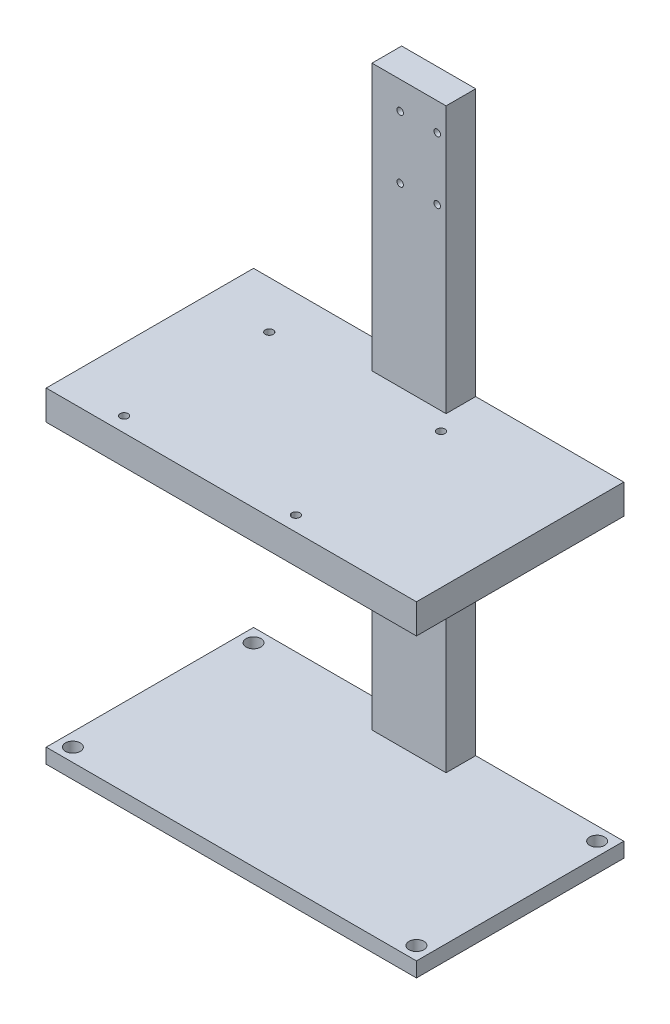
from build123d import *

# Parameters (mm, degrees)
SKETCH2_W           = 25
SKETCH2_H           = 90
SKETCH2_R           = 1.1
SKETCH2_H_2         = 10
SKETCH2_W_2         = 50
SKETCH2_H_3         = 100
BOSS_EXTRUDE3_DEPTH = 10
SKETCH5_W           = 125
SKETCH5_H           = 10
BOSS_EXTRUDE4_DEPTH = 60
SKETCH6_W           = 75
SKETCH6_H           = 5
BOSS_EXTRUDE5_DEPTH = 60
SKETCH8_W           = 10
SKETCH8_H           = 5
BOSS_EXTRUDE7_DEPTH = 50
SKETCH7_W           = 70
SKETCH7_H           = 5
BOSS_EXTRUDE8_DEPTH = 50
SKETCH12_R          = 2.5
CUT_EXTRUDE1_DEPTH  = 246.068129549
CUT_EXTRUDE2_REACH  = 186.752
SKETCH13_R          = 1.35


with BuildPart() as part:
    # Sketch2 → Boss-Extrude3 (new body)
    # profile 1 of 5: a face of its own
    with BuildSketch(Plane.XY):
        with Locations((-68.394568721, -43.658737525)):
            Rectangle(SKETCH2_W, SKETCH2_H)
        with Locations((-71.394568721, -29.020737525)):
            Circle(SKETCH2_R, mode=Mode.SUBTRACT)
        with Locations((-71.394568721, -8.020737525)):
            Circle(SKETCH2_R, mode=Mode.SUBTRACT)
        with Locations((-58.894568721, -29.020737525)):
            Circle(SKETCH2_R, mode=Mode.SUBTRACT)
        with Locations((-58.894568721, -8.020737525)):
            Circle(SKETCH2_R, mode=Mode.SUBTRACT)
    # profile 2 of 5: a face of its own
    with BuildSketch(Plane.XY):
        with Locations((-68.394568721, -93.658737525)):
            Rectangle(SKETCH2_W, SKETCH2_H_2)
    # profile 3 of 5: a face of its own
    with BuildSketch(Plane.XY):
        with Locations((-105.894568721, -93.658737525)):
            Rectangle(SKETCH2_W_2, SKETCH2_H_2)
    # profile 4 of 5: a face of its own
    with BuildSketch(Plane.XY):
        with Locations((-30.894568721, -93.658737525)):
            Rectangle(SKETCH2_W_2, SKETCH2_H_2)
    # profile 5 of 5: a face of its own
    with BuildSketch(Plane.XY):
        with Locations((-68.394568721, -148.658737525)):
            Rectangle(SKETCH2_W, SKETCH2_H_3)
    extrude(amount=BOSS_EXTRUDE3_DEPTH)

    # Sketch5 → Boss-Extrude4 (add)
    with BuildSketch(Plane.XY.offset(10)):
        with Locations((-68.394568721, -93.658737525)):
            Rectangle(SKETCH5_W, SKETCH5_H)
    extrude(amount=BOSS_EXTRUDE4_DEPTH)

    # Sketch6 → Boss-Extrude5 (add)
    with BuildSketch(Plane.XY.offset(10)):
        with Locations((-43.394568721, -196.158737525)):
            Rectangle(SKETCH6_W, SKETCH6_H)
    extrude(amount=BOSS_EXTRUDE5_DEPTH)

    # Sketch8 → Boss-Extrude7 (add)
    with BuildSketch(Plane(origin=(-55.894568721, 0, 0), x_dir=(0, 0, -1), z_dir=(1, 0, 0))):
        with Locations((-5, -196.158737525)):
            Rectangle(SKETCH8_W, SKETCH8_H)
    extrude(amount=BOSS_EXTRUDE7_DEPTH)

    # Sketch7 → Boss-Extrude8 (add)
    with BuildSketch(Plane.ZY.offset(80.894568721)):
        with Locations((35, -196.158737525)):
            Rectangle(SKETCH7_W, SKETCH7_H)
    extrude(amount=BOSS_EXTRUDE8_DEPTH)

    # Sketch12 → Cut-Extrude1 (cut, through all)
    with BuildSketch(Plane(origin=(0, -193.658737525, 0), x_dir=(1, 0, 0), z_dir=(0, 1, 0))):
        with Locations(Location((-126.394568721, -4.5, 0), (0, 0, 270))):
            Circle(SKETCH12_R)
        with Locations(Location((-126.394568721, -65.5, 0), (0, 0, 270))):
            Circle(SKETCH12_R)
        with Locations(Location((-10.394568721, -65.5, 0), (0, 0, 270))):
            Circle(SKETCH12_R)
        with Locations(Location((-10.394568721, -4.5, 0), (0, 0, 270))):
            Circle(SKETCH12_R)
    extrude(amount=-CUT_EXTRUDE1_DEPTH, mode=Mode.SUBTRACT)

    # Sketch13 → Cut-Extrude2 (cut, up to next)
    with BuildSketch(Plane(origin=(0, -88.658737525, 0), x_dir=(1, 0, 0), z_dir=(0, 1, 0)), mode=Mode.PRIVATE) as cut_extrude2_sk1:
        with Locations(Location((-109.594568721, -16, 0), (0, 0, 270))):
            Circle(SKETCH13_R)
    cut_extrude2_tool1 = extrude(cut_extrude2_sk1.sketch, amount=-CUT_EXTRUDE2_REACH, mode=Mode.PRIVATE) & part.part
    # Sketch13 → Cut-Extrude2 (cut, up to next)
    with BuildSketch(Plane(origin=(0, -88.658737525, 0), x_dir=(1, 0, 0), z_dir=(0, 1, 0)), mode=Mode.PRIVATE) as cut_extrude2_sk2:
        with Locations(Location((-109.594568721, -65, 0), (0, 0, 270))):
            Circle(SKETCH13_R)
    cut_extrude2_tool2 = extrude(cut_extrude2_sk2.sketch, amount=-CUT_EXTRUDE2_REACH, mode=Mode.PRIVATE) & part.part
    # Sketch13 → Cut-Extrude2 (cut, up to next)
    with BuildSketch(Plane(origin=(0, -88.658737525, 0), x_dir=(1, 0, 0), z_dir=(0, 1, 0)), mode=Mode.PRIVATE) as cut_extrude2_sk3:
        with Locations(Location((-51.594568721, -65, 0), (0, 0, 270))):
            Circle(SKETCH13_R)
    cut_extrude2_tool3 = extrude(cut_extrude2_sk3.sketch, amount=-CUT_EXTRUDE2_REACH, mode=Mode.PRIVATE) & part.part
    # Sketch13 → Cut-Extrude2 (cut, up to next)
    with BuildSketch(Plane(origin=(0, -88.658737525, 0), x_dir=(1, 0, 0), z_dir=(0, 1, 0)), mode=Mode.PRIVATE) as cut_extrude2_sk4:
        with Locations(Location((-51.594568721, -16, 0), (0, 0, 270))):
            Circle(SKETCH13_R)
    cut_extrude2_tool4 = extrude(cut_extrude2_sk4.sketch, amount=-CUT_EXTRUDE2_REACH, mode=Mode.PRIVATE) & part.part
    add(cut_extrude2_tool1.solids().sort_by_distance((-109.594569, -88.658738, 16))[0], mode=Mode.SUBTRACT)
    add(cut_extrude2_tool2.solids().sort_by_distance((-109.594569, -88.658738, 65))[0], mode=Mode.SUBTRACT)
    add(cut_extrude2_tool3.solids().sort_by_distance((-51.594569, -88.658738, 65))[0], mode=Mode.SUBTRACT)
    add(cut_extrude2_tool4.solids().sort_by_distance((-51.594569, -88.658738, 16))[0], mode=Mode.SUBTRACT)


solid = part.part
